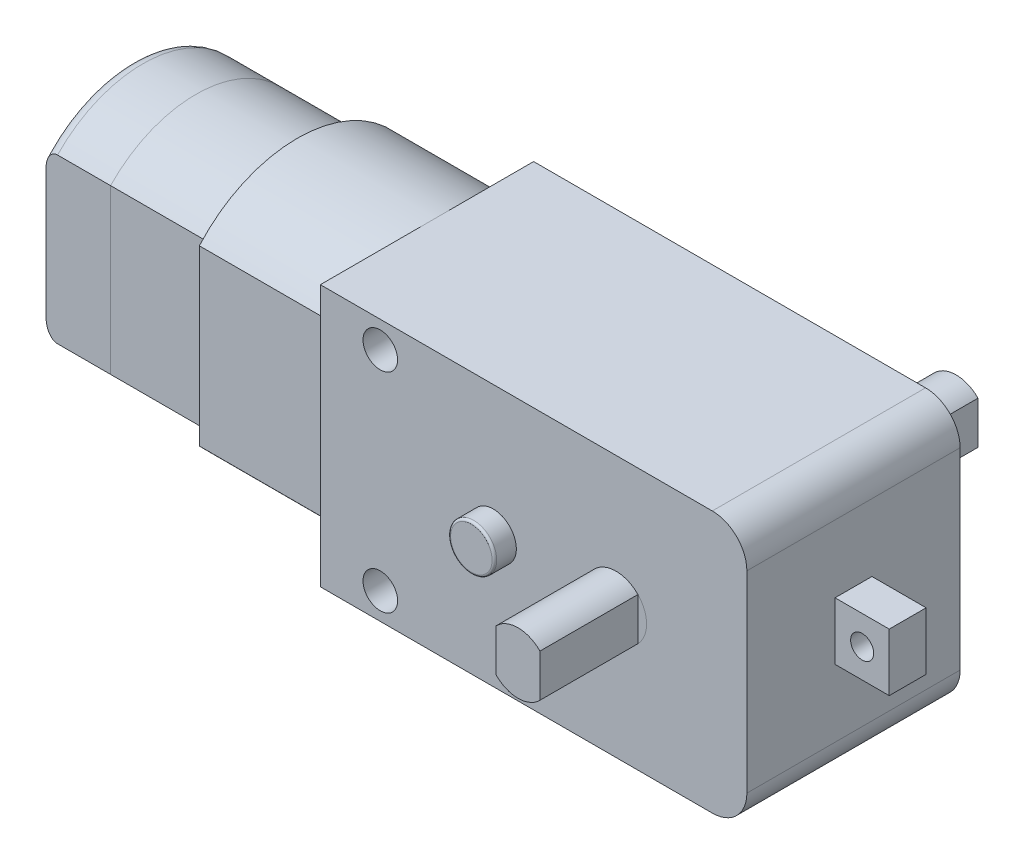
from build123d import *

# Parameters (mm, degrees)
SALIENTE_EXTRUIR1_DEPTH       = 9.25
SALIENTE_EXTRUIR1_DEPTH_BACK  = 9.25
SALIENTE_EXTRUIR2_DEPTH       = 12
CROQUIS3_W                    = 3.2
CROQUIS3_H                    = 5
SALIENTE_EXTRUIR3_DEPTH       = 4.7
CORTAR_EXTRUIR1_DEPTH         = 28
CORTAR_EXTRUIR1_DEPTH_BACK    = 17.7
CROQUIS4_R                    = 1.5
CROQUIS5_R                    = 2
SALIENTE_EXTRUIR4_DEPTH       = 1.9
REDONDEO1_R                   = 0.2
CROQUIS6_R                    = 2.65
CORTAR_EXTRUIR2_DEPTH         = 23.9
SALIENTE_EXTRUIR5_DEPTH       = 8.8
SALIENTE_EXTRUIR6_DEPTH       = 5.6
REDONDEO2_R                   = 1
SALIENTE_EXTRUIR7_DEPTH       = 2
CROQUIS12_R                   = 1
SALIENTE_EXTRUIR8_DEPTH       = 1
CROQUIS13_W                   = 3
CROQUIS13_H                   = 8
SALIENTE_EXTRUIR9_DEPTH       = 1.2
CROQUIS14_R                   = 1
CORTAR_EXTRUIR3_DEPTH         = 4.2
SALIENTE_EXTRUIR10_DEPTH      = 17.75
SALIENTE_EXTRUIR10_DEPTH_BACK = 20.25
SALIENTE_EXTRUIR11_DEPTH      = 9.25
SALIENTE_EXTRUIR11_DEPTH_BACK = 12.25
CROQUIS16_R                   = 2.65


with BuildPart() as part:
    # Croquis1 → Saliente-Extruir1 (new, two sides: drawn at the far end of the back side and taken through both)
    with BuildSketch(Plane.XY.offset(-SALIENTE_EXTRUIR1_DEPTH_BACK)):
        with BuildLine():
            Line((-18.5, -11.35), (15.5, -11.35))
            ThreePointArc((15.5, -11.35), (17.621320344, -10.471320344), (18.5, -8.35))
            Line((18.5, -8.35), (18.5, 8.35))
            ThreePointArc((18.5, 8.35), (17.621320344, 10.471320344), (15.5, 11.35))
            Line((15.5, 11.35), (-18.5, 11.35))
            Line((-18.5, 11.35), (-18.5, -11.35))
        make_face()
    extrude(amount=SALIENTE_EXTRUIR1_DEPTH + SALIENTE_EXTRUIR1_DEPTH_BACK)

    # Croquis2 → Saliente-Extruir2 (add)
    with BuildSketch(Plane.ZY.offset(18.5)):
        with BuildLine():
            Line((7.75, -7.521469271), (7.75, 7.521469271))
            ThreePointArc((7.75, 7.521469271), (-0.75, 11.35), (-9.25, 7.521469271))
            Line((-9.25, 7.521469271), (-9.25, -7.521469271))
            ThreePointArc((-9.25, -7.521469271), (-0.75, -11.35), (7.75, -7.521469271))
        make_face()
    extrude(amount=SALIENTE_EXTRUIR2_DEPTH)

    # Croquis3 → Saliente-Extruir3 (add)
    with BuildSketch(Plane(origin=(18.5, 0, 0), x_dir=(0, 0, -1), z_dir=(1, 0, 0))):
        Rectangle(CROQUIS3_W, CROQUIS3_H)
    extrude(amount=SALIENTE_EXTRUIR3_DEPTH)

    # Croquis4 → Cortar-Extruir1 (cut, two sides: drawn at the far end of the back side and taken through both)
    with BuildSketch(Plane.XY.offset(-CORTAR_EXTRUIR1_DEPTH_BACK)):
        with Locations(Location((-13.3, 9.05, 0), (0, 0, 180))):
            Circle(CROQUIS4_R)
        with Locations(Location((-13.3, -9.05, 0), (0, 0, 180))):
            Circle(CROQUIS4_R)
    extrude(amount=CORTAR_EXTRUIR1_DEPTH + CORTAR_EXTRUIR1_DEPTH_BACK, mode=Mode.SUBTRACT)

    # Croquis5 → Saliente-Extruir4 (add)
    with BuildSketch(Plane.XY.offset(9.25)):
        with Locations(Location((-3.5, 0, 0), (0, 0, 180))):
            Circle(CROQUIS5_R)
    extrude(amount=SALIENTE_EXTRUIR4_DEPTH)

    # Redondeo1
    redondeo1_edges = [part.edges().sort_by_distance(p)[0] for p in [
        (-1.5, 0, 11.15),
    ]]
    fillet(redondeo1_edges, radius=REDONDEO1_R)

    # Croquis6 → Cortar-Extruir2 (cut)
    with BuildSketch(Plane.XY.offset(9.25)):
        with Locations((7.15, 0)):
            Circle(CROQUIS6_R)
    extrude(amount=-CORTAR_EXTRUIR2_DEPTH, mode=Mode.SUBTRACT)

    # Croquis14 → Cortar-Extruir3 (cut)
    with BuildSketch(Plane.XY.offset(1.6)):
        with Locations((20.85, 0)):
            Circle(CROQUIS14_R)
    extrude(amount=-CORTAR_EXTRUIR3_DEPTH, mode=Mode.SUBTRACT)


with BuildPart() as body_2:
    # Croquis9 → Saliente-Extruir5 (new body)
    with BuildSketch(Plane.ZY.offset(30.5)):
        with BuildLine():
            Line((6.65, -7.092425537), (6.65, 7.092425537))
            ThreePointArc((6.65, 7.092425537), (-0.75, 10.25), (-8.15, 7.092425537))
            Line((-8.15, 7.092425537), (-8.15, -7.092425537))
            ThreePointArc((-8.15, -7.092425537), (-0.75, -10.25), (6.65, -7.092425537))
        make_face()
    extrude(amount=SALIENTE_EXTRUIR5_DEPTH)


with BuildPart() as body_3:
    # Croquis10 → Saliente-Extruir6 (new body)
    with BuildSketch(Plane.ZY.offset(39.3)):
        with BuildLine():
            Line((-8.15, 7.092425537), (-8.15, -7.092425537))
            ThreePointArc((-8.15, -7.092425537), (-0.75, -10.25), (6.65, -7.092425537))
            Line((6.65, -7.092425537), (6.65, 7.092425537))
            ThreePointArc((6.65, 7.092425537), (-0.75, 10.25), (-8.15, 7.092425537))
        make_face()
    extrude(amount=SALIENTE_EXTRUIR6_DEPTH)

    # Redondeo2
    redondeo2_edges = [body_3.edges().sort_by_distance(p)[0] for p in [
        (-44.9, -10.25, -0.75),
        (-44.9, 10.25, -0.75),
    ]]
    fillet(redondeo2_edges, radius=REDONDEO2_R)


with BuildPart() as body_4:
    # Croquis11 → Saliente-Extruir7 (new body)
    with BuildSketch(Plane.ZY.offset(44.9)):
        with BuildLine():
            Line((2.65, 3.666060556), (2.65, -3.666060556))
            ThreePointArc((2.65, -3.666060556), (-5.75, 0), (2.65, 3.666060556))
        make_face()
    extrude(amount=SALIENTE_EXTRUIR7_DEPTH)


with BuildPart() as body_5:
    # Croquis12 → Saliente-Extruir8 (new body)
    with BuildSketch(Plane.ZY.offset(46.9)):
        with Locations((-0.75, 0)):
            Circle(CROQUIS12_R)
    extrude(amount=SALIENTE_EXTRUIR8_DEPTH)


with BuildPart() as body_6:
    # Croquis13 → Saliente-Extruir9 (new body)
    with BuildSketch(Plane(origin=(0, 0, -8.15), x_dir=(-1, 0, 0), z_dir=(0, 0, -1))):
        with Locations((40.8, 0)):
            Rectangle(CROQUIS13_W, CROQUIS13_H)
    extrude(amount=SALIENTE_EXTRUIR9_DEPTH)


with BuildPart() as body_7:
    # Croquis15 → Saliente-Extruir10 (new, two sides: drawn at the far end of the back side and taken through both)
    with BuildSketch(Plane.XY.offset(-SALIENTE_EXTRUIR10_DEPTH_BACK)):
        with BuildLine():
            Line((9.05, -1.84729532), (9.05, 1.84729532))
            ThreePointArc((9.05, 1.84729532), (7.15, 2.65), (5.25, 1.84729532))
            Line((5.25, 1.84729532), (5.25, -1.84729532))
            ThreePointArc((5.25, -1.84729532), (7.15, -2.65), (9.05, -1.84729532))
        make_face()
    extrude(amount=SALIENTE_EXTRUIR10_DEPTH + SALIENTE_EXTRUIR10_DEPTH_BACK)


with BuildPart() as body_8:
    # Croquis16 → Saliente-Extruir11 (new, two sides: drawn at the far end of the back side and taken through both)
    with BuildSketch(Plane.XY.offset(-SALIENTE_EXTRUIR11_DEPTH_BACK)):
        with Locations((7.15, 0)):
            Circle(CROQUIS16_R)
    extrude(amount=SALIENTE_EXTRUIR11_DEPTH + SALIENTE_EXTRUIR11_DEPTH_BACK)


solid = Compound([part.part, body_2.part, body_3.part, body_4.part, body_5.part, body_6.part, body_7.part, body_8.part])
